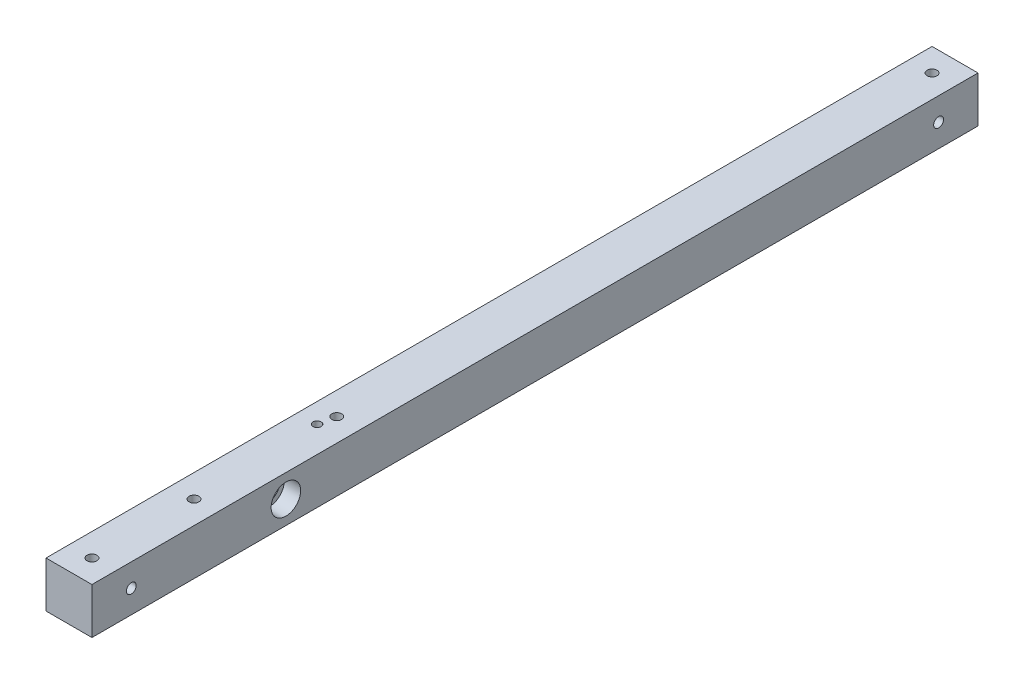
from build123d import *

# Parameters (mm, degrees)
IZIM1_W                     = 28
IZIM1_H                     = 28
Y_KSEKLIK_EKSTR_ZYON1_DEPTH = 270
IZIM3_R                     = 3
KES_EKSTR_ZYON2_DEPTH       = 272.808756298
IZIM4_R                     = 5
KES_EKSTR_ZYON3_DEPTH       = 7
IZIM5_R                     = 6
KES_EKSTR_ZYON4_DEPTH       = 272.808756298
IZIM6_R                     = 9
KES_EKSTR_ZYON5_DEPTH       = 10
IZIM7_R                     = 3
KES_EKSTR_ZYON6_DEPTH       = 272.808756298
IZIM8_R                     = 5
KES_EKSTR_ZYON7_DEPTH       = 7
SKETCH1_R                   = 3
CUT_EXTRUDE1_DEPTH          = 10
SKETCH2_R                   = 6
CUT_EXTRUDE2_DEPTH          = 20
SKETCH3_R                   = 2.5
CUT_EXTRUDE3_DEPTH          = 14


with BuildPart() as part:
    # Çizim1 → Yükseklik-Ekstrüzyon1 (new, symmetric)
    with BuildSketch(Plane.XY):
        Rectangle(IZIM1_W, IZIM1_H)
    extrude(amount=Y_KSEKLIK_EKSTR_ZYON1_DEPTH, both=True)

    # Çizim3 → Kes-Ekstrüzyon2 (cut, through all)
    with BuildSketch(Plane.XZ.offset(14)):
        with Locations(Location((0, -256, 0), (0, 0, 270))):
            Circle(IZIM3_R)
        with Locations(Location((0, 256, 0), (0, 0, 270))):
            Circle(IZIM3_R)
    extrude(amount=-KES_EKSTR_ZYON2_DEPTH, mode=Mode.SUBTRACT)

    # Çizim4 → Kes-Ekstrüzyon3 (cut)
    with BuildSketch(Plane.XZ.offset(14)):
        with Locations(Location((0, -256, 0), (0, 0, 270))):
            Circle(IZIM4_R)
        with Locations(Location((0, 256, 0), (0, 0, 270))):
            Circle(IZIM4_R)
    extrude(amount=-KES_EKSTR_ZYON3_DEPTH, mode=Mode.SUBTRACT)

    # Çizim5 → Kes-Ekstrüzyon4 (cut, through all)
    with BuildSketch(Plane(origin=(14, 0, 0), x_dir=(0, 0, -1), z_dir=(1, 0, 0))):
        with Locations((-151.8, 0)):
            Circle(IZIM5_R)
    extrude(amount=-KES_EKSTR_ZYON4_DEPTH, mode=Mode.SUBTRACT)

    # Çizim6 → Kes-Ekstrüzyon5 (cut)
    with BuildSketch(Plane(origin=(14, 0, 0), x_dir=(0, 0, -1), z_dir=(1, 0, 0))):
        with Locations((-151.8, 0)):
            Circle(IZIM6_R)
    extrude(amount=-KES_EKSTR_ZYON5_DEPTH, mode=Mode.SUBTRACT)

    # Çizim7 → Kes-Ekstrüzyon6 (cut, through all)
    with BuildSketch(Plane.ZY.offset(14)):
        with Locations((-246, 0)):
            Circle(IZIM7_R)
        with Locations((246, 0)):
            Circle(IZIM7_R)
    extrude(amount=-KES_EKSTR_ZYON6_DEPTH, mode=Mode.SUBTRACT)

    # Çizim8 → Kes-Ekstrüzyon7 (cut)
    with BuildSketch(Plane.ZY.offset(14)):
        with Locations((-246, 0)):
            Circle(IZIM8_R)
        with Locations((246, 0)):
            Circle(IZIM8_R)
    extrude(amount=-KES_EKSTR_ZYON7_DEPTH, mode=Mode.SUBTRACT)

    # Sketch1 → Cut-Extrude1 (cut)
    with BuildSketch(Plane(origin=(0, 14, 0), x_dir=(1, 0, 0), z_dir=(0, 1, 0))):
        with Locations(Location((0, -106.8, 0), (0, 0, 270))):
            Circle(SKETCH1_R)
        with Locations(Location((0, -193.8, 0), (0, 0, 270))):
            Circle(SKETCH1_R)
    extrude(amount=-CUT_EXTRUDE1_DEPTH, mode=Mode.SUBTRACT)

    # Sketch2 → Cut-Extrude2 (cut)
    with BuildSketch(Plane.ZY.offset(14)):
        with Locations((116.8, 0)):
            Circle(SKETCH2_R)
    extrude(amount=-CUT_EXTRUDE2_DEPTH, mode=Mode.SUBTRACT)

    # Sketch3 → Cut-Extrude3 (cut)
    with BuildSketch(Plane(origin=(0, 14, 0), x_dir=(1, 0, 0), z_dir=(0, 1, 0))):
        with Locations(Location((-2, -116.8, 0), (0, 0, 270))):
            Circle(SKETCH3_R)
    extrude(amount=-CUT_EXTRUDE3_DEPTH, mode=Mode.SUBTRACT)


solid = part.part
